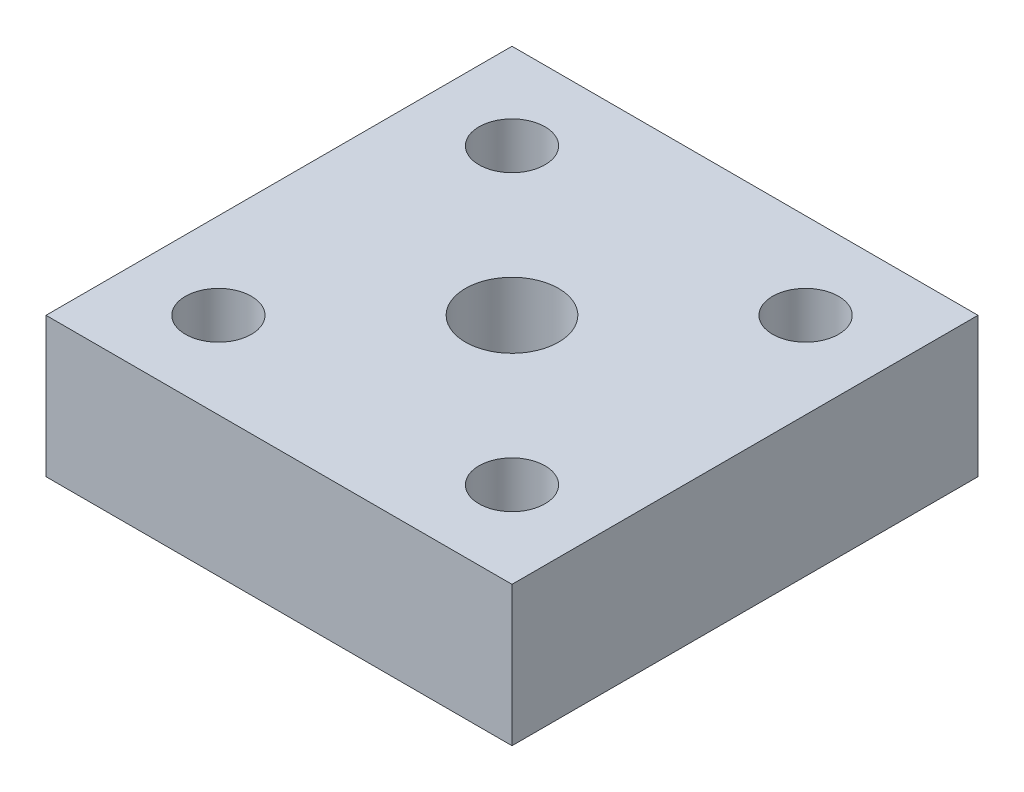
from build123d import *

# Parameters (mm, degrees)
SKETCH1_W           = 63.5
SKETCH1_H           = 63.5
SKETCH1_R           = 6.35
BOSS_EXTRUDE1_DEPTH = 19.05
SKETCH3_R           = 4.4958
CUT_EXTRUDE2_DEPTH  = 19.05


with BuildPart() as part:
    # Sketch1 → Boss-Extrude1 (new body)
    with BuildSketch(Plane(origin=(0, 0, 0), x_dir=(1, 0, 0), z_dir=(0, 1, 0))):
        with Locations((-4.445666472, -11.8618)):
            Rectangle(SKETCH1_W, SKETCH1_H)
        with Locations(Location((-4.445666472, -11.8618, 0), (0, 0, 90))):
            Circle(SKETCH1_R, mode=Mode.SUBTRACT)
    extrude(amount=BOSS_EXTRUDE1_DEPTH)

    # Sketch3 → Cut-Extrude2 (cut)
    with BuildSketch(Plane(origin=(0, 0, 0), x_dir=(1, 0, 0), z_dir=(0, 1, 0))):
        with Locations(Location((-24.448166472, 8.1407, 0), (0, 0, 90))):
            Circle(SKETCH3_R)
        with Locations(Location((15.556833528, 8.1407, 0), (0, 0, 90))):
            Circle(SKETCH3_R)
        with Locations(Location((15.556833528, -31.8643, 0), (0, 0, 90))):
            Circle(SKETCH3_R)
        with Locations(Location((-24.448166472, -31.8643, 0), (0, 0, 90))):
            Circle(SKETCH3_R)
    extrude(amount=CUT_EXTRUDE2_DEPTH, mode=Mode.SUBTRACT)


solid = part.part
